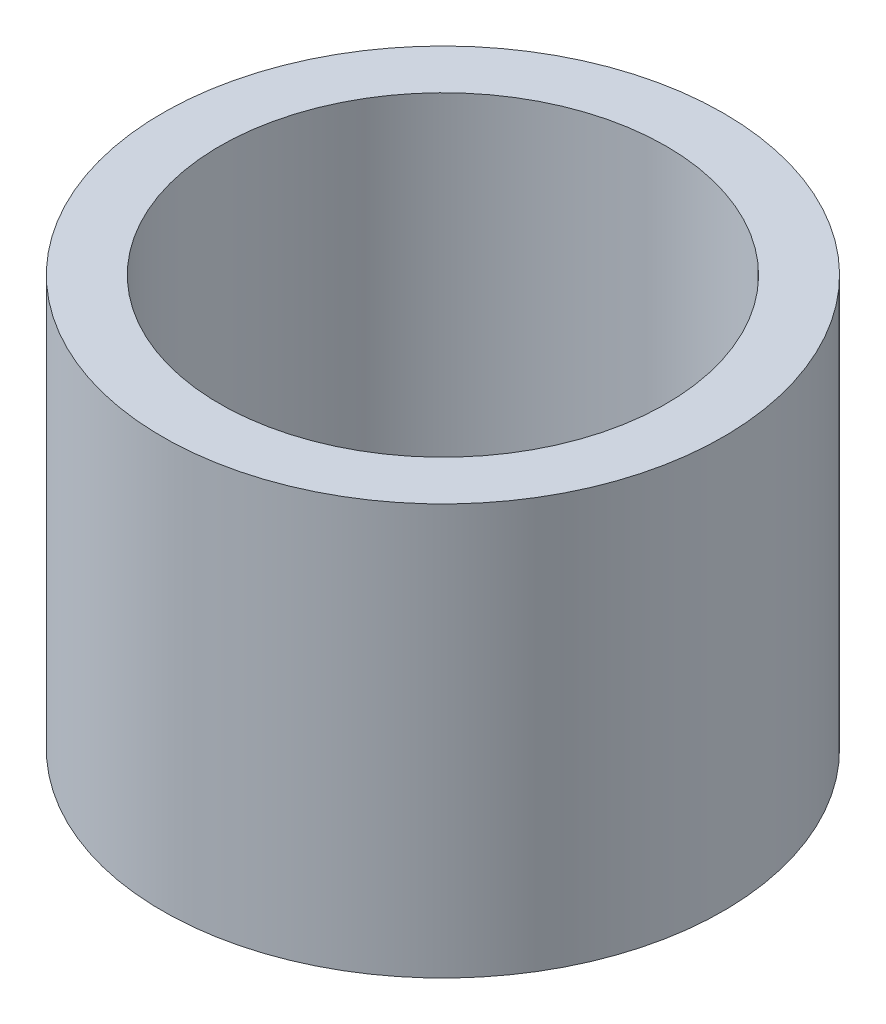
from build123d import *

# Parameters (mm, degrees)
CROQUIS1_W = 10
CROQUIS1_H = 71.739130434


with BuildPart() as part:
    # Croquis1 → Revolución1 (revolve)
    with BuildSketch(Plane(origin=(0, 0, 0), x_dir=(0, 0, -1), z_dir=(1, 0, 0)), mode=Mode.PRIVATE) as revoluci_n1_sk:
        with Locations((-44, -10)):
            Rectangle(CROQUIS1_W, CROQUIS1_H)
    revolve(revoluci_n1_sk.sketch.rotate(Axis((0, 0, 0), (0, 1, 0)), 180), axis=Axis((0, 0, 0), (0, 1, 0)))


solid = part.part
